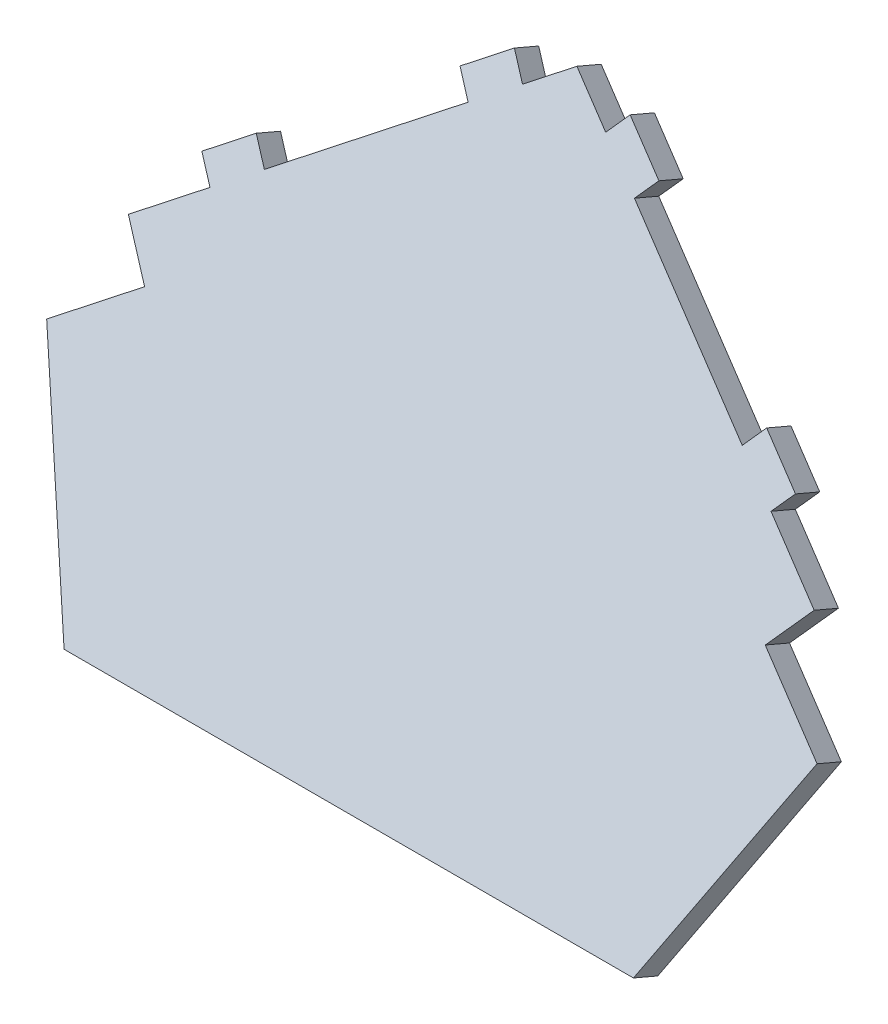
from build123d import *

# Parameters (mm, degrees)
BOSS_EXTRU_2_DEPTH = 5


with BuildPart() as part:
    # Esquisse3D1 → Boss.-Extru.2 (new body)
    with BuildSketch(Plane(origin=(0, 0, -20), x_dir=(0.440651848036545, -0.8252970730775361, 0.35314400744119906), z_dir=(0, -0.39339715689728005, -0.9193686295198118))):
        Polygon((0, 0), (2.064889772, 9.784489268), (-2.827354862, 10.816934154), (-0.76246509, 20.601423421), (4.129779544, 19.568978535), (11.865292841, 56.223742318), (6.973048207, 57.256187204), (9.037937979, 67.040676471), (13.930182613, 66.008231585), (17.027517271, 80.684965487), (26.812006539, 78.620075715), (30.528808128, 96.232156396), (74.821304729, 96.775888054), (122.326612599, 0), (94.804862198, -34.708416185), (78.59808061, -26.876415767), (74.246969266, -35.880183316), (60.741317943, -29.353516301), (58.565762271, -33.855400075), (49.561994722, -29.504288732), (51.737550394, -25.002404957), (18.007535098, -8.702222687), (15.831979426, -13.204106461), (6.828211877, -8.852995118), (9.003767549, -4.351111343), align=None)
    extrude(amount=BOSS_EXTRU_2_DEPTH)


solid = part.part
